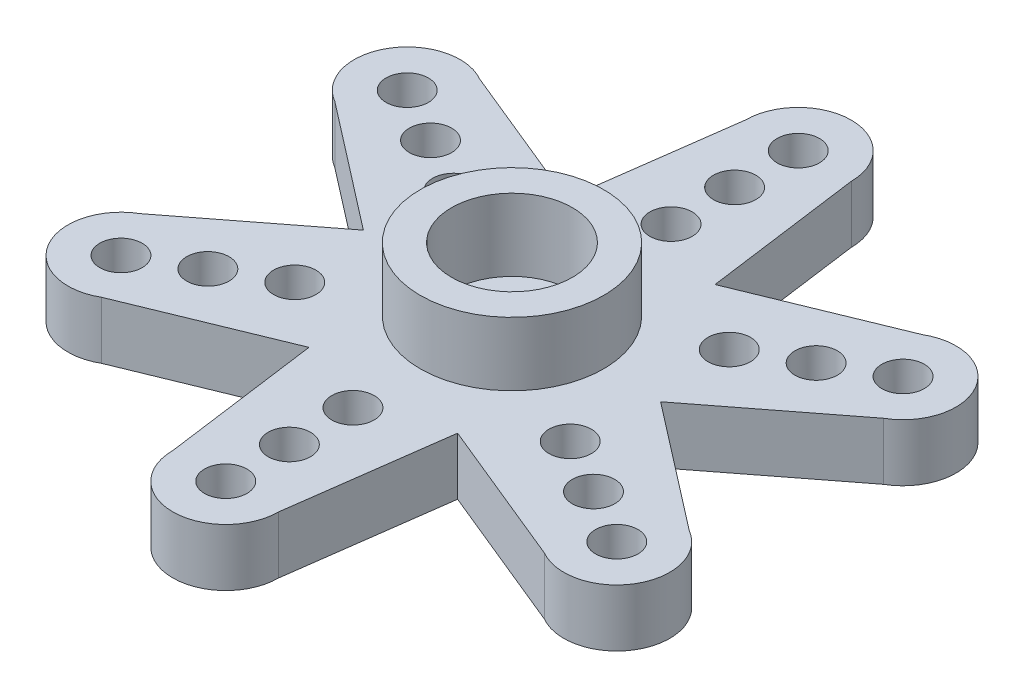
from build123d import *

# Parameters (mm, degrees)
SKETCH1_R                    = 4.325
BOSS_EXTRUDE1_DEPTH          = 3
SKETCH2_R                    = 2.5
BOSS_EXTRUDE2_DEPTH          = 2.7
SKETCH3_R                    = 1
CUT_EXTRUDE1_DEPTH           = 2.7
LPATTERN1_COUNT              = 3
LPATTERN1_PITCH              = 3
CIRPATTERN1_COUNT            = 6
CIRPATTERN1_COPY_1_SKETCH_R  = 1
CIRPATTERN1_COPY_1_DEPTH     = 2.7
CIRPATTERN1_COPY_2_SKETCH_R  = 1
CIRPATTERN1_COPY_2_DEPTH     = 2.7
CIRPATTERN1_COPY_3_SKETCH_R  = 1
CIRPATTERN1_COPY_3_DEPTH     = 2.7
CIRPATTERN1_COPY_4_SKETCH_R  = 1
CIRPATTERN1_COPY_4_DEPTH     = 2.7
CIRPATTERN1_COPY_5_SKETCH_R  = 1
CIRPATTERN1_COPY_5_DEPTH     = 2.7
CIRPATTERN1_COPY_6_SKETCH_R  = 1
CIRPATTERN1_COPY_6_DEPTH     = 2.7
CIRPATTERN1_COPY_7_SKETCH_R  = 1
CIRPATTERN1_COPY_7_DEPTH     = 2.7
CIRPATTERN1_COPY_8_SKETCH_R  = 1
CIRPATTERN1_COPY_8_DEPTH     = 2.7
CIRPATTERN1_COPY_9_SKETCH_R  = 1
CIRPATTERN1_COPY_9_DEPTH     = 2.7
CIRPATTERN1_COPY_10_SKETCH_R = 1
CIRPATTERN1_COPY_10_DEPTH    = 2.7
SKETCH6_R                    = 2.85
CUT_EXTRUDE2_DEPTH           = 3.4
CUT_EXTRUDE3_REACH           = 23.655
SKETCH7_R                    = 1.5


with BuildPart() as part:
    # Sketch1 → Boss-Extrude1 (new body)
    with BuildSketch(Plane(origin=(0, 0, 0), x_dir=(1, 0, 0), z_dir=(0, 1, 0))):
        with Locations(Location((0, 0, 0), (0, 0, 270))):
            Circle(SKETCH1_R)
    extrude(amount=BOSS_EXTRUDE1_DEPTH)

    # Sketch2 → Boss-Extrude2 (add)
    with BuildSketch(Plane(origin=(0, 0, 0), x_dir=(1, 0, 0), z_dir=(0, 1, 0))):
        with Locations((0, 13.5)):
            Circle(SKETCH2_R)
        Polygon((-4.325, 0), (4.325, 0), (2.5, 13.5), (-2.5, 13.5), align=None)
    boss_extrude2 = extrude(amount=-BOSS_EXTRUDE2_DEPTH)

    # Sketch3 → Cut-Extrude1 (cut)
    with BuildSketch(Plane(origin=(0, 0, 0), x_dir=(1, 0, 0), z_dir=(0, 1, 0))):
        with Locations(Location((0, 13.5, 0), (0, 0, 270))):
            Circle(SKETCH3_R)
    cut_extrude1 = extrude(amount=-CUT_EXTRUDE1_DEPTH, mode=Mode.SUBTRACT)

    # LPattern1: Cut-Extrude1 ×3
    with Locations(*[(0, 0, i * LPATTERN1_PITCH) for i in range(1, LPATTERN1_COUNT)]):
        add(cut_extrude1, mode=Mode.SUBTRACT)

    # CirPattern1: Boss-Extrude2, Cut-Extrude1 ×6 about axis
    cirpattern1_axis = Axis((0, 0, 0), (0, 1, 0))
    add([boss_extrude2.rotate(cirpattern1_axis, i * 360 / CIRPATTERN1_COUNT) for i in range(1, CIRPATTERN1_COUNT)])
    add([cut_extrude1.rotate(cirpattern1_axis, i * 360 / CIRPATTERN1_COUNT) for i in range(1, CIRPATTERN1_COUNT)], mode=Mode.SUBTRACT)

    # CirPattern1 copy 1 sketch → CirPattern1 copy 1 (cut)
    with BuildSketch(Plane(origin=(2.598076211, 0, 1.5), x_dir=(0.5000000000000001, 0, -0.8660254037844386), z_dir=(0, 1, 0))):
        with Locations(Location((0, 13.5, 0), (0, 0, 270))):
            Circle(CIRPATTERN1_COPY_1_SKETCH_R)
    extrude(amount=-CIRPATTERN1_COPY_1_DEPTH, mode=Mode.SUBTRACT)

    # CirPattern1 copy 2 sketch → CirPattern1 copy 2 (cut)
    with BuildSketch(Plane(origin=(2.598076211, 0, -1.5), x_dir=(-0.4999999999999998, 0, -0.8660254037844387), z_dir=(0, 1, 0))):
        with Locations(Location((0, 13.5, 0), (0, 0, 270))):
            Circle(CIRPATTERN1_COPY_2_SKETCH_R)
    extrude(amount=-CIRPATTERN1_COPY_2_DEPTH, mode=Mode.SUBTRACT)

    # CirPattern1 copy 3 sketch → CirPattern1 copy 3 (cut)
    with BuildSketch(Plane(origin=(0, 0, -3), x_dir=(-1, 0, 0), z_dir=(0, 1, 0))):
        with Locations(Location((0, 13.5, 0), (0, 0, 270))):
            Circle(CIRPATTERN1_COPY_3_SKETCH_R)
    extrude(amount=-CIRPATTERN1_COPY_3_DEPTH, mode=Mode.SUBTRACT)

    # CirPattern1 copy 4 sketch → CirPattern1 copy 4 (cut)
    with BuildSketch(Plane(origin=(-2.598076211, 0, -1.5), x_dir=(-0.5000000000000004, 0, 0.8660254037844384), z_dir=(0, 1, 0))):
        with Locations(Location((0, 13.5, 0), (0, 0, 270))):
            Circle(CIRPATTERN1_COPY_4_SKETCH_R)
    extrude(amount=-CIRPATTERN1_COPY_4_DEPTH, mode=Mode.SUBTRACT)

    # CirPattern1 copy 5 sketch → CirPattern1 copy 5 (cut)
    with BuildSketch(Plane(origin=(-2.598076211, 0, 1.5), x_dir=(0.5000000000000001, 0, 0.8660254037844386), z_dir=(0, 1, 0))):
        with Locations(Location((0, 13.5, 0), (0, 0, 270))):
            Circle(CIRPATTERN1_COPY_5_SKETCH_R)
    extrude(amount=-CIRPATTERN1_COPY_5_DEPTH, mode=Mode.SUBTRACT)

    # CirPattern1 copy 6 sketch → CirPattern1 copy 6 (cut)
    with BuildSketch(Plane(origin=(5.196152423, 0, 3), x_dir=(0.5000000000000001, 0, -0.8660254037844386), z_dir=(0, 1, 0))):
        with Locations(Location((0, 13.5, 0), (0, 0, 270))):
            Circle(CIRPATTERN1_COPY_6_SKETCH_R)
    extrude(amount=-CIRPATTERN1_COPY_6_DEPTH, mode=Mode.SUBTRACT)

    # CirPattern1 copy 7 sketch → CirPattern1 copy 7 (cut)
    with BuildSketch(Plane(origin=(5.196152423, 0, -3), x_dir=(-0.4999999999999998, 0, -0.8660254037844387), z_dir=(0, 1, 0))):
        with Locations(Location((0, 13.5, 0), (0, 0, 270))):
            Circle(CIRPATTERN1_COPY_7_SKETCH_R)
    extrude(amount=-CIRPATTERN1_COPY_7_DEPTH, mode=Mode.SUBTRACT)

    # CirPattern1 copy 8 sketch → CirPattern1 copy 8 (cut)
    with BuildSketch(Plane(origin=(0, 0, -6), x_dir=(-1, 0, 0), z_dir=(0, 1, 0))):
        with Locations(Location((0, 13.5, 0), (0, 0, 270))):
            Circle(CIRPATTERN1_COPY_8_SKETCH_R)
    extrude(amount=-CIRPATTERN1_COPY_8_DEPTH, mode=Mode.SUBTRACT)

    # CirPattern1 copy 9 sketch → CirPattern1 copy 9 (cut)
    with BuildSketch(Plane(origin=(-5.196152423, 0, -3), x_dir=(-0.5000000000000004, 0, 0.8660254037844384), z_dir=(0, 1, 0))):
        with Locations(Location((0, 13.5, 0), (0, 0, 270))):
            Circle(CIRPATTERN1_COPY_9_SKETCH_R)
    extrude(amount=-CIRPATTERN1_COPY_9_DEPTH, mode=Mode.SUBTRACT)

    # CirPattern1 copy 10 sketch → CirPattern1 copy 10 (cut)
    with BuildSketch(Plane(origin=(-5.196152423, 0, 3), x_dir=(0.5000000000000001, 0, 0.8660254037844386), z_dir=(0, 1, 0))):
        with Locations(Location((0, 13.5, 0), (0, 0, 270))):
            Circle(CIRPATTERN1_COPY_10_SKETCH_R)
    extrude(amount=-CIRPATTERN1_COPY_10_DEPTH, mode=Mode.SUBTRACT)

    # Sketch6 → Cut-Extrude2 (cut)
    with BuildSketch(Plane(origin=(0, 3, 0), x_dir=(1, 0, 0), z_dir=(0, 1, 0))):
        with Locations(Location((0, 0, 0), (0, 0, 270))):
            Circle(SKETCH6_R)
    extrude(amount=-CUT_EXTRUDE2_DEPTH, mode=Mode.SUBTRACT)

    # Sketch7 → Cut-Extrude3 (cut, up to next)
    with BuildSketch(Plane(origin=(0, -0.4, 0), x_dir=(1, 0, 0), z_dir=(0, 1, 0)), mode=Mode.PRIVATE) as cut_extrude3_sk1:
        with Locations(Location((0, 0, 0), (0, 0, 270))):
            Circle(SKETCH7_R)
    cut_extrude3_tool1 = extrude(cut_extrude3_sk1.sketch, amount=-CUT_EXTRUDE3_REACH, mode=Mode.PRIVATE) & part.part
    add(cut_extrude3_tool1.solids().sort_by_distance((0, -0.4, 0))[0], mode=Mode.SUBTRACT)


solid = part.part
